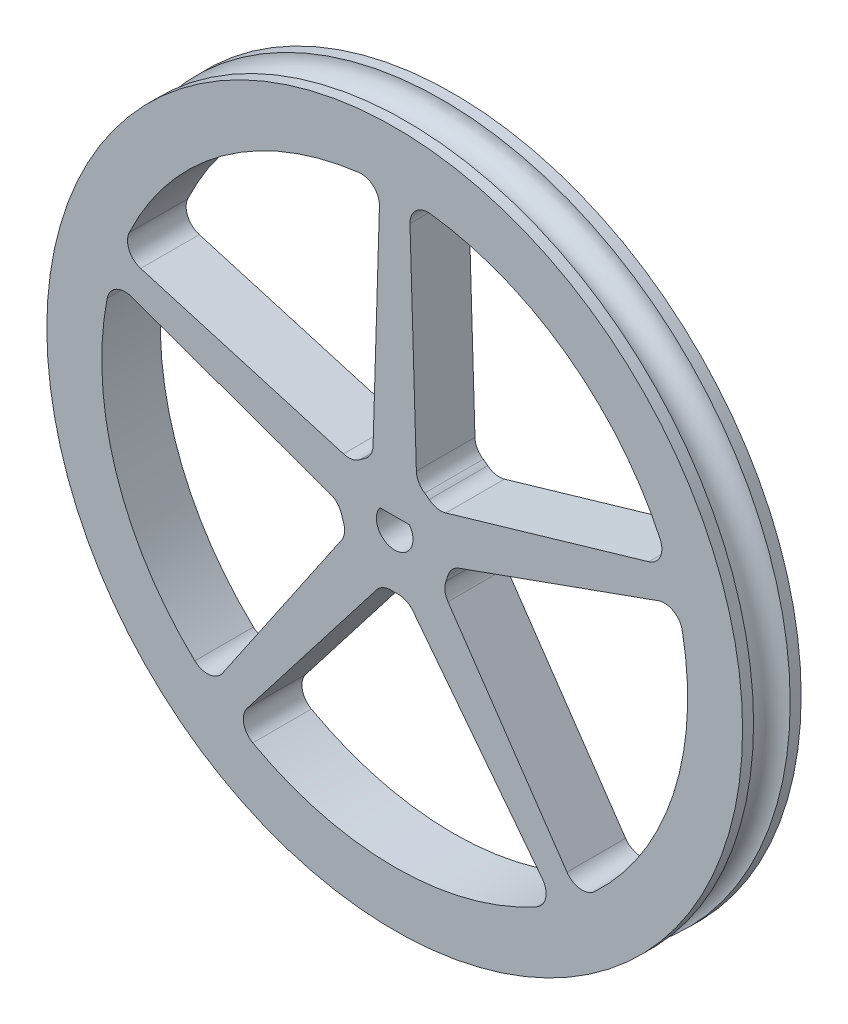
from build123d import *

# Parameters (mm, degrees)
SKETCH1_R           = 30.1625
BOSS_EXTRUDE1_DEPTH = 2.54
SKETCH2_R           = 1.5875
CUT_EXTRUDE1_DEPTH  = 43.957644401
FILLET1_R           = 1.5875


with BuildPart() as part:
    # Sketch1 → Boss-Extrude1 (new, symmetric)
    with BuildSketch(Plane.XY):
        Circle(SKETCH1_R)
        with BuildLine():
            Line((1.27, 0.9525), (-1.27, 0.9525))
            ThreePointArc((-1.27, 0.9525), (0, -1.5875), (1.27, 0.9525))
        make_face(mode=Mode.SUBTRACT)
    extrude(amount=BOSS_EXTRUDE1_DEPTH, both=True)

    # Sketch2 → Cut-Revolve1 (revolve, cut)
    with BuildSketch(Plane(origin=(0, 0, 0), x_dir=(1, 0, 0), z_dir=(0, 1, 0))):
        with Locations((30.1625, 0)):
            Circle(SKETCH2_R)
    revolve(axis=Axis((0, 0, 0), (0, 0, -1)), mode=Mode.SUBTRACT)

    # Sketch4 → Cut-Extrude1 (cut, through all)
    with BuildSketch(Plane.XY.offset(2.54)):
        with BuildLine():
            ThreePointArc((-3.562592399, 3.160591977), (-2.799327264, 3.852943436), (-1.905, 4.364903349))
            Line((-1.905, 4.364903349), (-1.27, 25.368230131))
            ThreePointArc((-1.27, 25.368230131), (-14.929745408, 20.549031657), (-23.73416899, 9.047056004))
            Line((-23.73416899, 9.047056004), (-3.562592399, 3.160591977))
        make_face()
        with BuildLine():
            Line((1.27, 25.368230131), (1.905, 4.364903349))
            ThreePointArc((1.905, 4.364903349), (2.799327264, 3.852943436), (3.562592399, 3.160591977))
            Line((3.562592399, 3.160591977), (23.73416899, 9.047056004))
            ThreePointArc((23.73416899, 9.047056004), (14.929745408, 20.549031657), (1.27, 25.368230131))
        make_face()
        with BuildLine():
            ThreePointArc((25.4, 0), (25.178804904, 3.344814437), (24.519072156, 6.631372452))
            Line((24.519072156, 6.631372452), (4.739947148, -0.46293335))
            ThreePointArc((4.739947148, -0.46293335), (4.529406659, -1.471693436), (4.106803191, -2.411550083))
            Line((4.106803191, -2.411550083), (15.938523131, -19.776842023))
            ThreePointArc((15.938523131, -19.776842023), (22.912861972, -10.961786179), (25.4, 0))
        make_face()
        with BuildLine():
            ThreePointArc((1.024448442, -4.651011894), (0, -4.7625), (-1.024448442, -4.651011894))
            Line((-1.024448442, -4.651011894), (-13.883619965, -21.269816564))
            ThreePointArc((-13.883619965, -21.269816564), (0, -25.4), (13.883619965, -21.269816564))
            Line((13.883619965, -21.269816564), (1.024448442, -4.651011894))
        make_face()
        with BuildLine():
            ThreePointArc((-4.106803191, -2.411550083), (-4.529406659, -1.471693436), (-4.739947148, -0.46293335))
            Line((-4.739947148, -0.46293335), (-24.519072156, 6.631372452))
            ThreePointArc((-24.519072156, 6.631372452), (-24.156835514, -7.849031657), (-15.938523131, -19.776842023))
            Line((-15.938523131, -19.776842023), (-4.106803191, -2.411550083))
        make_face()
    extrude(amount=-CUT_EXTRUDE1_DEPTH, mode=Mode.SUBTRACT)

    # Fillet1
    fillet1_edges = [part.edges().sort_by_distance(p)[0] for p in [
        (15.938523131, -19.776842023, 0),
        (4.106803191, -2.411550083, 0),
        (4.739947148, -0.46293335, 0),
        (24.519072156, 6.631372452, 0),
        (23.73416899, 9.047056004, 0),
        (3.562592399, 3.160591977, 0),
        (1.905, 4.364903349, 0),
        (1.27, 25.368230131, 0),
        (-24.519072156, 6.631372452, 0),
        (-4.739947148, -0.46293335, 0),
        (-4.106803191, -2.411550083, 0),
        (-15.938523131, -19.776842023, 0),
        (-13.883619965, -21.269816564, 0),
        (-1.024448442, -4.651011894, 0),
        (1.024448442, -4.651011894, 0),
        (13.883619965, -21.269816564, 0),
        (-1.27, 25.368230131, 0),
        (-1.905, 4.364903349, 0),
        (-3.562592399, 3.160591977, 0),
        (-23.73416899, 9.047056004, 0),
    ]]
    fillet(fillet1_edges, radius=FILLET1_R)


solid = part.part
